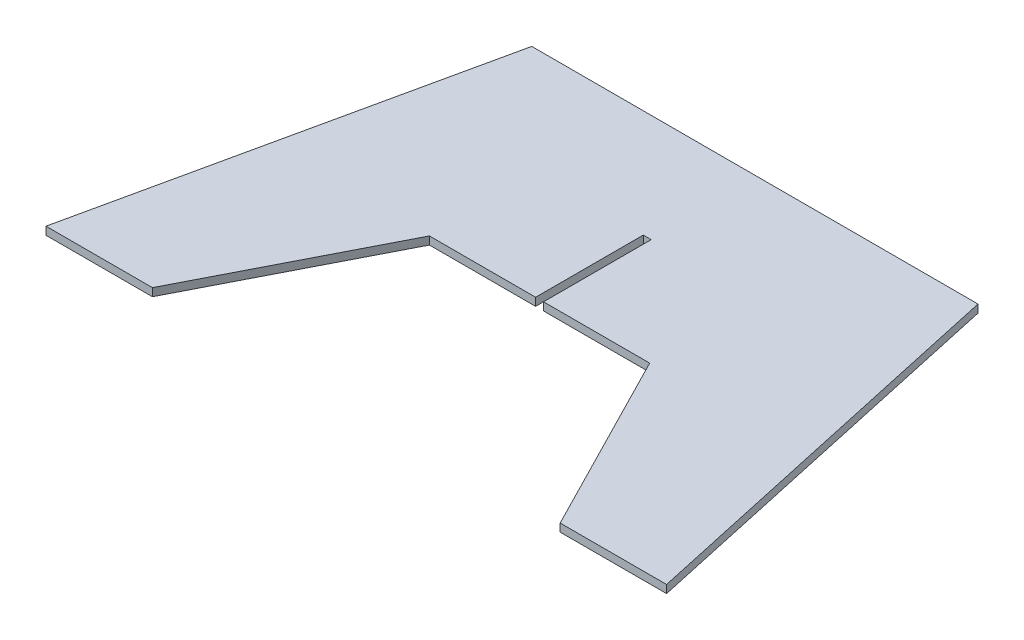
from build123d import *

# Parameters (mm, degrees)
BOSS_EXTRUDE1_DEPTH = 0.8636


with BuildPart() as part:
    # Sketch1 → Boss-Extrude1 (new body)
    with BuildSketch(Plane(origin=(0, 0, 0), x_dir=(1, 0, 0), z_dir=(0, 1, 0))):
        Polygon((-33.8636, 0), (-22.25, 0), (-12.020114943, 20), (-0.4318, 20), (-0.4318, 31.75), (0.4318, 31.75), (0.4318, 20), (12.020114943, 20), (22.25, 0), (33.8636, 0), (24.35, 43.5), (-24.35, 43.5), align=None)
    extrude(amount=BOSS_EXTRUDE1_DEPTH)


solid = part.part
